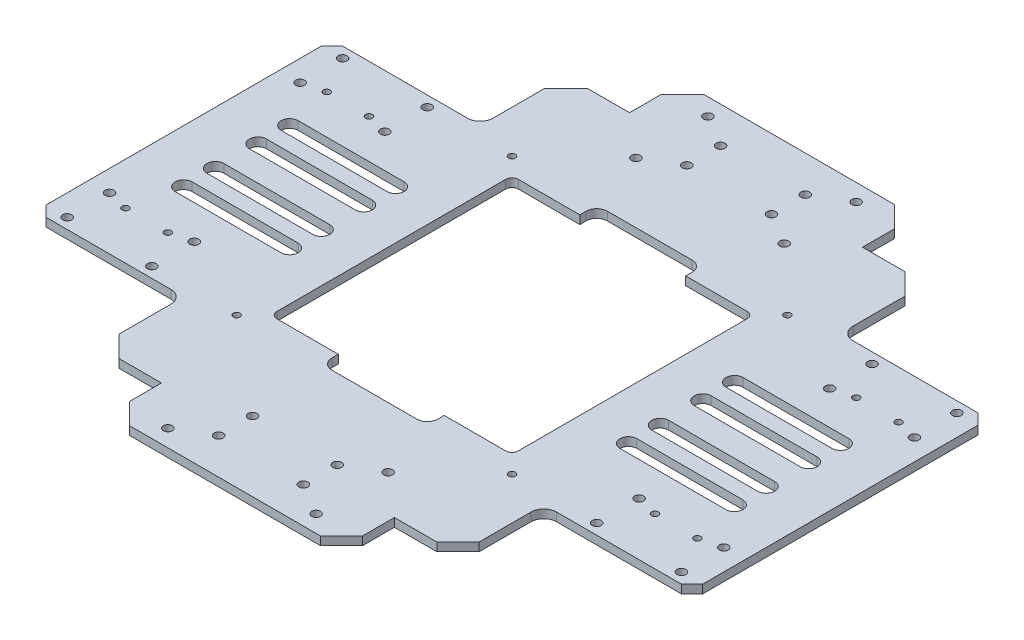
from build123d import *

# Parameters (mm, degrees)
SKETCH_1_W          = 110
SKETCH_1_H          = 270.99984649
SKETCH_1_R          = 2.1
EXTRUDE_1_DEPTH     = 4
CHAMFER_1_SIZE      = 10
CUT_EXTRUDE_1_DEPTH = 4
FILLET_1_R          = 5
EXTRUDE_2_DEPTH     = 4
CHAMFER_2_SIZE      = 10
FILLET_3_R          = 5
SKETCH_5_R          = 1.6
CUT_EXTRUDE_2_DEPTH = 4
SKETCH_7_W          = 70
SKETCH_7_H          = 140
EXTRUDE_3_DEPTH     = 4
FILLET_4_R          = 6
SKETCH_8_R          = 2.1
CUT_EXTRUDE_3_DEPTH = 4
SKETCH_9_R          = 1.6
CUT_EXTRUDE_4_DEPTH = 4
CHAMFER_3_SIZE      = 5
SKETCH_11_W         = 114
SKETCH_11_H         = 114.028365308
CUT_EXTRUDE_5_DEPTH = 10
FILLET_5_R          = 3


with BuildPart() as part:
    # 草图1 → 凸台-拉伸1 (new body)
    with BuildSketch(Plane(origin=(0, 0, 0), x_dir=(1, 0, 0), z_dir=(0, 1, 0))):
        Rectangle(SKETCH_1_W, SKETCH_1_H)
        with Locations(Location((-35, 127.499923245, 0), (0, 0, 270))):
            Circle(SKETCH_1_R, mode=Mode.SUBTRACT)
        with Locations(Location((-20, 118.499923245, 0), (0, 0, 270))):
            Circle(SKETCH_1_R, mode=Mode.SUBTRACT)
        with Locations(Location((20, 118.499923245, 0), (0, 0, 270))):
            Circle(SKETCH_1_R, mode=Mode.SUBTRACT)
        with Locations(Location((35, 127.499923245, 0), (0, 0, 270))):
            Circle(SKETCH_1_R, mode=Mode.SUBTRACT)
        with Locations(Location((20, 102.499923245, 0), (0, 0, 270))):
            Circle(SKETCH_1_R, mode=Mode.SUBTRACT)
        with Locations(Location((35, 93.499923245, 0), (0, 0, 270))):
            Circle(SKETCH_1_R, mode=Mode.SUBTRACT)
        with Locations(Location((-35, 93.499923245, 0), (0, 0, 270))):
            Circle(SKETCH_1_R, mode=Mode.SUBTRACT)
        with Locations(Location((-20, 102.499923245, 0), (0, 0, 270))):
            Circle(SKETCH_1_R, mode=Mode.SUBTRACT)
        with Locations(Location((-35, -127.499923245, 0), (0, 0, 270))):
            Circle(SKETCH_1_R, mode=Mode.SUBTRACT)
        with Locations(Location((-20, -118.499923245, 0), (0, 0, 270))):
            Circle(SKETCH_1_R, mode=Mode.SUBTRACT)
        with Locations(Location((-20, -102.499923245, 0), (0, 0, 270))):
            Circle(SKETCH_1_R, mode=Mode.SUBTRACT)
        with Locations(Location((20, -118.499923245, 0), (0, 0, 270))):
            Circle(SKETCH_1_R, mode=Mode.SUBTRACT)
        with Locations(Location((20, -102.499923245, 0), (0, 0, 270))):
            Circle(SKETCH_1_R, mode=Mode.SUBTRACT)
        with Locations(Location((35, -93.499923245, 0), (0, 0, 270))):
            Circle(SKETCH_1_R, mode=Mode.SUBTRACT)
        with Locations(Location((35, -127.499923245, 0), (0, 0, 270))):
            Circle(SKETCH_1_R, mode=Mode.SUBTRACT)
    extrude(amount=EXTRUDE_1_DEPTH)

    # 倒角1
    chamfer_1_edges = [part.edges().sort_by_distance(p)[0] for p in [
        (55, 2, -135.499923245),
        (55, 2, 135.499923245),
        (-55, 2, 135.499923245),
        (-55, 2, -135.499923245),
    ]]
    chamfer(chamfer_1_edges, length=CHAMFER_1_SIZE)

    # 草图2 → 切除-拉伸1 (cut)
    with BuildSketch(Plane(origin=(0, 4, 0), x_dir=(1, 0, 0), z_dir=(0, 1, 0))):
        Polygon((-25, 45), (-40, 30), (-40, -30), (-25, -45), (-25, -65), (25, -65), (25, -45), (40, -30), (40, 30), (25, 45), (25, 65), (-25, 65), align=None)
    extrude(amount=-CUT_EXTRUDE_1_DEPTH, mode=Mode.SUBTRACT)

    # 圆角1
    fillet_1_edges = [part.edges().sort_by_distance(p)[0] for p in [
        (25, 2, -65),
        (25, 2, 65),
        (-25, 2, 65),
        (-25, 2, -65),
    ]]
    fillet(fillet_1_edges, radius=FILLET_1_R)

    # 草图3 → 凸台-拉伸2 (add)
    with BuildSketch(Plane(origin=(0, 4, 0), x_dir=(1, 0, 0), z_dir=(0, 1, 0))):
        Polygon((55, 110.499923245), (85, 110.499923245), (85, 93.499923245), (85, -102.499923245), (85, -110.499923245), (55, -110.499923245), (55, -102.499923245), (55, 93.499923245), align=None)
        Polygon((-85, 93.499923245), (-85, -102.499923245), (-85, -110.499923245), (-55, -110.499923245), (-55, -102.499923245), (-55, 93.499923245), (-55, 110.499923245), (-85, 110.499923245), align=None)
    extrude(amount=-EXTRUDE_2_DEPTH)

    # 倒角2
    chamfer_2_edges = [part.edges().sort_by_distance(p)[0] for p in [
        (-85, 2, 110.499923245),
        (85, 2, 110.499923245),
        (85, 2, -110.499923245),
        (-85, 2, -110.499923245),
    ]]
    chamfer(chamfer_2_edges, length=CHAMFER_2_SIZE)

    # 圆角3
    fillet_3_edges = [part.edges().sort_by_distance(p)[0] for p in [
        (40, 2, -30),
        (40, 2, 30),
        (-40, 2, 30),
        (-40, 2, -30),
    ]]
    fillet(fillet_3_edges, radius=FILLET_3_R)

    # 草图5 → 切除-拉伸2 (cut)
    with BuildSketch(Plane(origin=(0, 4, 0), x_dir=(1, 0, 0), z_dir=(0, 1, 0))):
        with Locations(Location((-65, 65, 0), (0, 0, 270))):
            Circle(SKETCH_5_R)
        with Locations(Location((65, 65, 0), (0, 0, 270))):
            Circle(SKETCH_5_R)
        with Locations(Location((65, -65, 0), (0, 0, 270))):
            Circle(SKETCH_5_R)
        with Locations(Location((-65, -65, 0), (0, 0, 270))):
            Circle(SKETCH_5_R)
    extrude(amount=-CUT_EXTRUDE_2_DEPTH, mode=Mode.SUBTRACT)

    # 草图7 → 凸台-拉伸3 (add)
    with BuildSketch(Plane(origin=(0, 4, 0), x_dir=(1, 0, 0), z_dir=(0, 1, 0))):
        Polygon((-85, 0), (-85, 70), (-155, 70), (-155, -70), (-85, -70), align=None)
        with Locations((120, 0)):
            Rectangle(SKETCH_7_W, SKETCH_7_H)
    extrude(amount=-EXTRUDE_3_DEPTH)

    # 圆角4
    fillet_4_edges = [part.edges().sort_by_distance(p)[0] for p in [
        (-85, 2, 70),
        (-85, 2, -70),
        (85, 2, 70),
        (85, 2, -70),
    ]]
    fillet(fillet_4_edges, radius=FILLET_4_R)

    # 草图8 → 切除-拉伸3 (cut)
    with BuildSketch(Plane(origin=(0, 4, 0), x_dir=(1, 0, 0), z_dir=(0, 1, 0))):
        with Locations(Location((105, 65, 0), (0, 0, 270))):
            Circle(SKETCH_8_R)
        with Locations(Location((145, 65, 0), (0, 0, 270))):
            Circle(SKETCH_8_R)
        with Locations(Location((145, 45, 0), (0, 0, 270))):
            Circle(SKETCH_8_R)
        with Locations(Location((105, 45, 0), (0, 0, 270))):
            Circle(SKETCH_8_R)
        with Locations(Location((145, -45, 0), (0, 0, 270))):
            Circle(SKETCH_8_R)
        with Locations(Location((145, -65, 0), (0, 0, 270))):
            Circle(SKETCH_8_R)
        with Locations(Location((105, -65, 0), (0, 0, 270))):
            Circle(SKETCH_8_R)
        with Locations(Location((105, -45, 0), (0, 0, 270))):
            Circle(SKETCH_8_R)
        with Locations(Location((-145, 65, 0), (0, 0, 270))):
            Circle(SKETCH_8_R)
        with Locations(Location((-105, 65, 0), (0, 0, 270))):
            Circle(SKETCH_8_R)
        with Locations(Location((-105, 45, 0), (0, 0, 270))):
            Circle(SKETCH_8_R)
        with Locations(Location((-145, 45, 0), (0, 0, 270))):
            Circle(SKETCH_8_R)
        with Locations(Location((-145, -45, 0), (0, 0, 270))):
            Circle(SKETCH_8_R)
        with Locations(Location((-105, -45, 0), (0, 0, 270))):
            Circle(SKETCH_8_R)
        with Locations(Location((-105, -65, 0), (0, 0, 270))):
            Circle(SKETCH_8_R)
        with Locations(Location((-145, -65, 0), (0, 0, 270))):
            Circle(SKETCH_8_R)
    extrude(amount=-CUT_EXTRUDE_3_DEPTH, mode=Mode.SUBTRACT)

    # 草图9 → 切除-拉伸4 (cut)
    with BuildSketch(Plane(origin=(0, 4, 0), x_dir=(1, 0, 0), z_dir=(0, 1, 0))):
        with Locations(Location((-135, 47.5, 0), (0, 0, 270))):
            Circle(SKETCH_9_R)
        with Locations(Location((-115, 47.5, 0), (0, 0, 90))):
            Circle(SKETCH_9_R)
        with Locations(Location((-115, -47.5, 0), (0, 0, 270))):
            Circle(SKETCH_9_R)
        with Locations(Location((-135, -47.5, 0), (0, 0, 90))):
            Circle(SKETCH_9_R)
        with Locations(Location((135, -47.5, 0), (0, 0, 270))):
            Circle(SKETCH_9_R)
        with Locations(Location((115, -47.5, 0), (0, 0, 90))):
            Circle(SKETCH_9_R)
        with Locations(Location((115, 47.5, 0), (0, 0, 270))):
            Circle(SKETCH_9_R)
        with Locations(Location((135, 47.5, 0), (0, 0, 90))):
            Circle(SKETCH_9_R)
        with BuildLine():
            Line((-130, 29.028690408), (-80, 29.028690408))
            ThreePointArc((-80, 29.028690408), (-76, 25.028690408), (-80, 21.028690408))
            Line((-80, 21.028690408), (-130, 21.028690408))
            ThreePointArc((-130, 21.028690408), (-134, 25.028690408), (-130, 29.028690408))
        make_face()
        with BuildLine():
            Line((-130, 14.028690408), (-80, 14.028690408))
            ThreePointArc((-80, 14.028690408), (-76, 10.028690408), (-80, 6.028690408))
            Line((-80, 6.028690408), (-130, 6.028690408))
            ThreePointArc((-130, 6.028690408), (-134, 10.028690408), (-130, 14.028690408))
        make_face()
        with BuildLine():
            Line((-130, -29.028690408), (-80, -29.028690408))
            ThreePointArc((-80, -29.028690408), (-76, -25.028690408), (-80, -21.028690408))
            Line((-80, -21.028690408), (-130, -21.028690408))
            ThreePointArc((-130, -21.028690408), (-134, -25.028690408), (-130, -29.028690408))
        make_face()
        with BuildLine():
            Line((-130, -14.028690408), (-80, -14.028690408))
            ThreePointArc((-80, -14.028690408), (-76, -10.028690408), (-80, -6.028690408))
            Line((-80, -6.028690408), (-130, -6.028690408))
            ThreePointArc((-130, -6.028690408), (-134, -10.028690408), (-130, -14.028690408))
        make_face()
        with BuildLine():
            Line((130, 29.028690408), (80, 29.028690408))
            ThreePointArc((80, 29.028690408), (76, 25.028690408), (80, 21.028690408))
            Line((80, 21.028690408), (130, 21.028690408))
            ThreePointArc((130, 21.028690408), (134, 25.028690408), (130, 29.028690408))
        make_face()
        with BuildLine():
            Line((130, 14.028690408), (80, 14.028690408))
            ThreePointArc((80, 14.028690408), (76, 10.028690408), (80, 6.028690408))
            Line((80, 6.028690408), (130, 6.028690408))
            ThreePointArc((130, 6.028690408), (134, 10.028690408), (130, 14.028690408))
        make_face()
        with BuildLine():
            Line((130, -29.028690408), (80, -29.028690408))
            ThreePointArc((80, -29.028690408), (76, -25.028690408), (80, -21.028690408))
            Line((80, -21.028690408), (130, -21.028690408))
            ThreePointArc((130, -21.028690408), (134, -25.028690408), (130, -29.028690408))
        make_face()
        with BuildLine():
            Line((130, -14.028690408), (80, -14.028690408))
            ThreePointArc((80, -14.028690408), (76, -10.028690408), (80, -6.028690408))
            Line((80, -6.028690408), (130, -6.028690408))
            ThreePointArc((130, -6.028690408), (134, -10.028690408), (130, -14.028690408))
        make_face()
    extrude(amount=-CUT_EXTRUDE_4_DEPTH, mode=Mode.SUBTRACT)

    # 倒角3
    chamfer_3_edges = [part.edges().sort_by_distance(p)[0] for p in [
        (155, 2, -70),
        (155, 2, 70),
        (-155, 2, 70),
        (-155, 2, -70),
    ]]
    chamfer(chamfer_3_edges, length=CHAMFER_3_SIZE)

    # 草图11 → 切除-拉伸5 (cut)
    with BuildSketch(Plane(origin=(0, 4, 0), x_dir=(1, 0, 0), z_dir=(0, 1, 0))):
        Rectangle(SKETCH_11_W, SKETCH_11_H)
    extrude(amount=-CUT_EXTRUDE_5_DEPTH, mode=Mode.SUBTRACT)

    # 圆角5
    fillet_5_edges = [part.edges().sort_by_distance(p)[0] for p in [
        (-57, 2, 57.014182654),
        (57, 2, -57.014182654),
        (57, 2, 57.014182654),
        (-57, 2, -57.014182654),
    ]]
    fillet(fillet_5_edges, radius=FILLET_5_R)


solid = part.part
